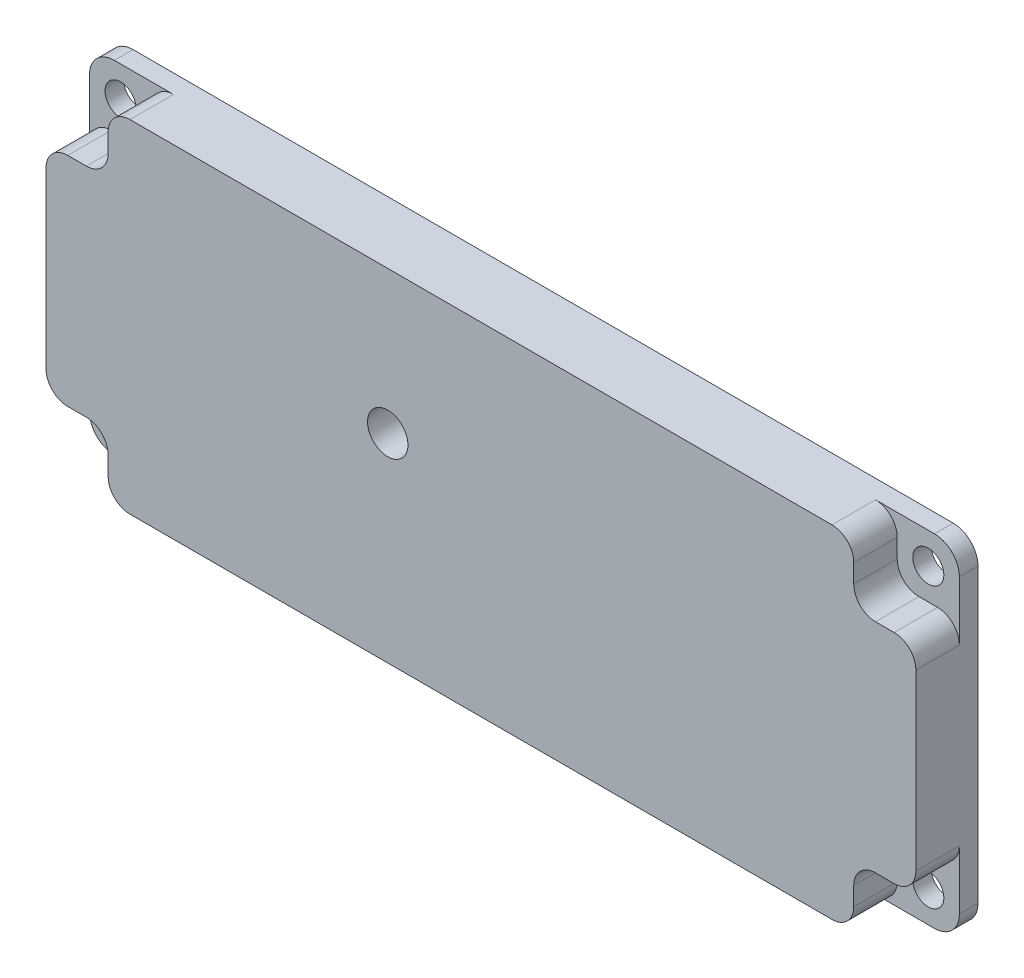
from build123d import *

# Parameters (mm, degrees)
SKETCH1_R           = 3.25
BOSS_EXTRUDE1_DEPTH = 10
CUT_EXTRUDE1_DEPTH  = 7
SKETCH3_R           = 2.5
CUT_EXTRUDE2_DEPTH  = 10
FILLET1_R           = 3.5


with BuildPart() as part:
    # Sketch1 → Boss-Extrude1 (new body)
    with BuildSketch(Plane.XY):
        with BuildLine():
            Line((-73.747603834, 33.92172524), (58.252396166, 33.92172524))
            ThreePointArc((58.252396166, 33.92172524), (61.080823291, 32.750152364), (62.252396166, 29.92172524))
            Line((62.252396166, 29.92172524), (62.252396166, -17.07827476))
            ThreePointArc((62.252396166, -17.07827476), (61.080823291, -19.906701885), (58.252396166, -21.07827476))
            Line((58.252396166, -21.07827476), (-73.747603834, -21.07827476))
            ThreePointArc((-73.747603834, -21.07827476), (-76.576030959, -19.906701885), (-77.747603834, -17.07827476))
            Line((-77.747603834, -17.07827476), (-77.747603834, 29.92172524))
            ThreePointArc((-77.747603834, 29.92172524), (-76.576030959, 32.750152364), (-73.747603834, 33.92172524))
        make_face()
        with Locations((-22.747603834, 10.92172524)):
            Circle(SKETCH1_R, mode=Mode.SUBTRACT)
    extrude(amount=BOSS_EXTRUDE1_DEPTH)

    # Sketch2 → Cut-Extrude1 (cut)
    with BuildSketch(Plane.XY.offset(10)):
        with BuildLine():
            Line((-77.747603834, 23.92172524), (-71.247603834, 23.92172524))
            ThreePointArc((-71.247603834, 23.92172524), (-68.7727301, 24.946851505), (-67.747603834, 27.42172524))
            Line((-67.747603834, 27.42172524), (-67.747603834, 33.92172524))
            Line((-67.747603834, 33.92172524), (-77.747603834, 33.92172524))
            Line((-77.747603834, 33.92172524), (-77.747603834, 23.92172524))
        make_face()
        with BuildLine():
            Line((-77.747603834, -11.07827476), (-71.247603834, -11.07827476))
            ThreePointArc((-71.247603834, -11.07827476), (-68.7727301, -12.103401026), (-67.747603834, -14.57827476))
            Line((-67.747603834, -14.57827476), (-67.747603834, -21.07827476))
            Line((-67.747603834, -21.07827476), (-77.747603834, -21.07827476))
            Line((-77.747603834, -21.07827476), (-77.747603834, -11.07827476))
        make_face()
        with BuildLine():
            Line((52.252396166, -21.07827476), (62.252396166, -21.07827476))
            Line((62.252396166, -21.07827476), (62.252396166, -11.07827476))
            Line((62.252396166, -11.07827476), (55.752396166, -11.07827476))
            ThreePointArc((55.752396166, -11.07827476), (53.277522432, -12.103401026), (52.252396166, -14.57827476))
            Line((52.252396166, -14.57827476), (52.252396166, -21.07827476))
        make_face()
        with BuildLine():
            Line((62.252396166, 23.92172524), (55.752396166, 23.92172524))
            ThreePointArc((55.752396166, 23.92172524), (53.277522432, 24.946851505), (52.252396166, 27.42172524))
            Line((52.252396166, 27.42172524), (52.252396166, 33.92172524))
            Line((52.252396166, 33.92172524), (62.252396166, 33.92172524))
            Line((62.252396166, 33.92172524), (62.252396166, 23.92172524))
        make_face()
    extrude(amount=-CUT_EXTRUDE1_DEPTH, mode=Mode.SUBTRACT)

    # Sketch3 → Cut-Extrude2 (cut)
    with BuildSketch(Plane.XY.offset(3)):
        with Locations((-72.747603834, 28.92172524)):
            Circle(SKETCH3_R)
        with Locations((57.252396166, 28.92172524)):
            Circle(SKETCH3_R)
        with Locations((57.252396166, -16.07827476)):
            Circle(SKETCH3_R)
        with Locations((-72.747603834, -16.07827476)):
            Circle(SKETCH3_R)
    extrude(amount=-CUT_EXTRUDE2_DEPTH, mode=Mode.SUBTRACT)

    # Fillet1
    fillet1_edges = [part.edges().sort_by_distance(p)[0] for p in [
        (52.252396166, 33.92172524, 6.5),
        (62.252396166, 23.92172524, 6.5),
        (62.252396166, -11.07827476, 6.5),
        (52.252396166, -21.07827476, 6.5),
        (-67.747603834, -21.07827476, 6.5),
        (-77.747603834, -11.07827476, 6.5),
        (-77.747603834, 23.92172524, 6.5),
        (-67.747603834, 33.92172524, 6.5),
    ]]
    fillet(fillet1_edges, radius=FILLET1_R)


solid = part.part
